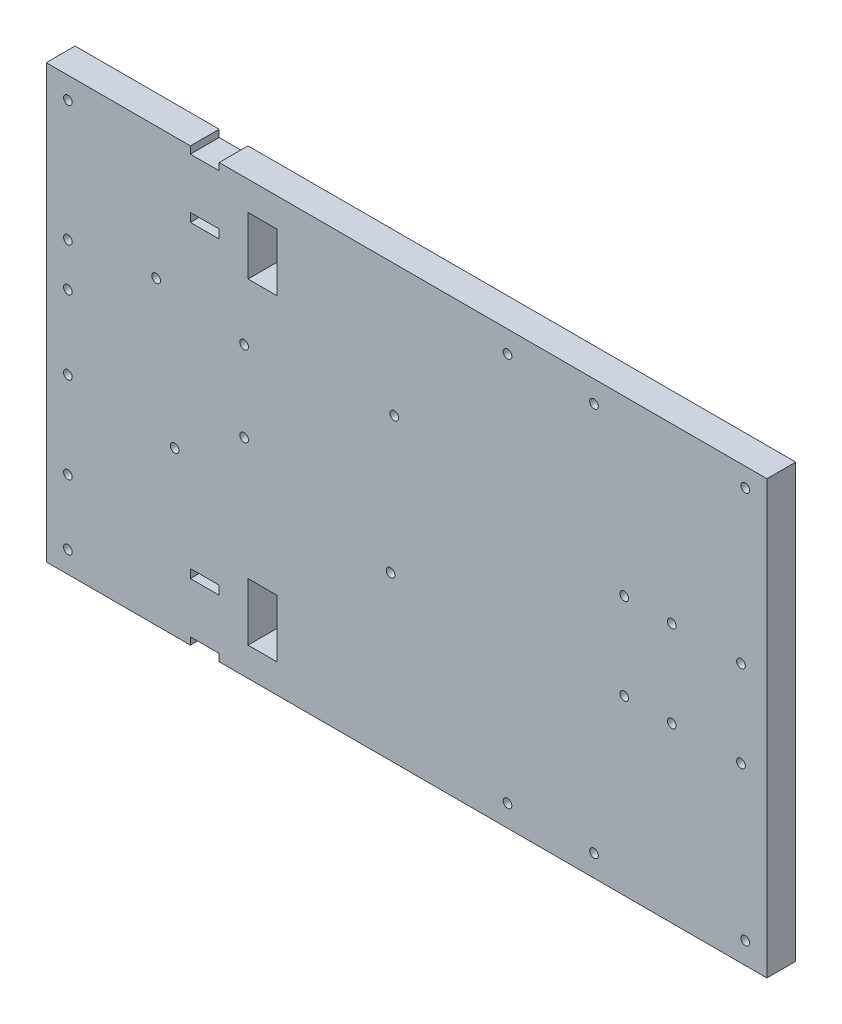
from build123d import *

# Parameters (mm, degrees)
SKETCH1_R           = 1.5
SKETCH1_W           = 10
SKETCH1_H           = 3
SKETCH1_H_2         = 20
BOSS_EXTRUDE1_DEPTH = 10


with BuildPart() as part:
    # Sketch1 → Boss-Extrude1 (new body)
    with BuildSketch(Plane.XY):
        Polygon((-125, -75), (-75, -75), (-75, -72.5), (-65, -72.5), (-65, -75), (-25, -75), (-15, -75), (125, -75), (125, 75), (-15, 75), (-25, 75), (-65, 75), (-65, 72.5), (-75, 72.5), (-75, 75), (-125, 75), align=None)
        with Locations((75.5, 15)):
            Circle(SKETCH1_R, mode=Mode.SUBTRACT)
        with Locations((75.5, -15)):
            Circle(SKETCH1_R, mode=Mode.SUBTRACT)
        with Locations((-117.5, -15)):
            Circle(SKETCH1_R, mode=Mode.SUBTRACT)
        with Locations((-117.5, -45)):
            Circle(SKETCH1_R, mode=Mode.SUBTRACT)
        with Locations((35.010304949, -67.5)):
            Circle(SKETCH1_R, mode=Mode.SUBTRACT)
        with Locations((65.010304949, -67.5)):
            Circle(SKETCH1_R, mode=Mode.SUBTRACT)
        with Locations((35.010304949, 67.5)):
            Circle(SKETCH1_R, mode=Mode.SUBTRACT)
        with Locations((65.010304949, 67.5)):
            Circle(SKETCH1_R, mode=Mode.SUBTRACT)
        with Locations((-117.5, 25.573512729)):
            Circle(SKETCH1_R, mode=Mode.SUBTRACT)
        with Locations((-117.5, 10.573512729)):
            Circle(SKETCH1_R, mode=Mode.SUBTRACT)
        with Locations((-5.559425317, -18.495275092)):
            Circle(SKETCH1_R, mode=Mode.SUBTRACT)
        with Locations((-80.459425317, -18.495275092)):
            Circle(SKETCH1_R, mode=Mode.SUBTRACT)
        with Locations((-86.859425317, 29.304724908)):
            Circle(SKETCH1_R, mode=Mode.SUBTRACT)
        with Locations((-4.259425317, 29.304724908)):
            Circle(SKETCH1_R, mode=Mode.SUBTRACT)
        with Locations((-56.359425317, 24.604724908)):
            Circle(SKETCH1_R, mode=Mode.SUBTRACT)
        with Locations((-56.359425317, -3.295275092)):
            Circle(SKETCH1_R, mode=Mode.SUBTRACT)
        with Locations((92, 15)):
            Circle(SKETCH1_R, mode=Mode.SUBTRACT)
        with Locations((116, 15)):
            Circle(SKETCH1_R, mode=Mode.SUBTRACT)
        with Locations((116, -15)):
            Circle(SKETCH1_R, mode=Mode.SUBTRACT)
        with Locations((92, -15)):
            Circle(SKETCH1_R, mode=Mode.SUBTRACT)
        with Locations((-117.5, 67.5)):
            Circle(SKETCH1_R, mode=Mode.SUBTRACT)
        with Locations((117.5, 68.5)):
            Circle(SKETCH1_R, mode=Mode.SUBTRACT)
        with Locations((117.5, -67.5)):
            Circle(SKETCH1_R, mode=Mode.SUBTRACT)
        with Locations((-117.5, -67.5)):
            Circle(SKETCH1_R, mode=Mode.SUBTRACT)
        with Locations((-70, -53.5)):
            Rectangle(SKETCH1_W, SKETCH1_H, mode=Mode.SUBTRACT)
        with Locations((-70, 53.5)):
            Rectangle(SKETCH1_W, SKETCH1_H, mode=Mode.SUBTRACT)
        with Locations((-50, -55)):
            Rectangle(SKETCH1_W, SKETCH1_H_2, mode=Mode.SUBTRACT)
        with Locations((-50, 55)):
            Rectangle(SKETCH1_W, SKETCH1_H_2, mode=Mode.SUBTRACT)
    extrude(amount=BOSS_EXTRUDE1_DEPTH)


solid = part.part
